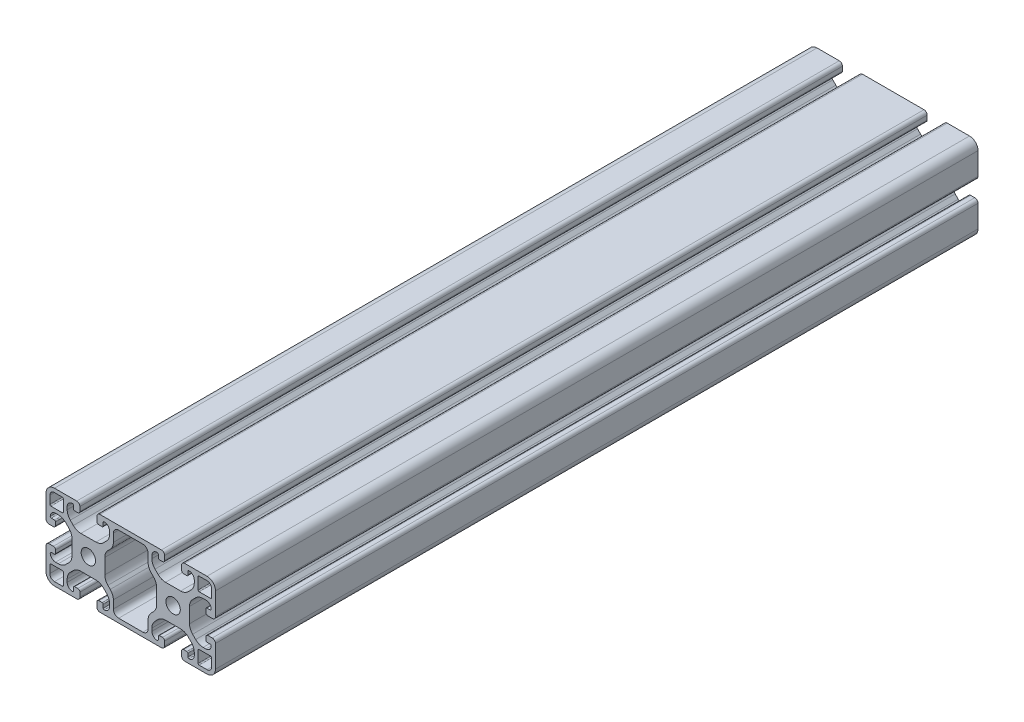
from build123d import *

# Parameters (mm, degrees)
ESQUISSE1_R        = 3.4
BOSS_EXTRU_1_DEPTH = 360


with BuildPart() as part:
    # Esquisse1 → Boss.-Extru.1 (new body)
    with BuildSketch(Plane.XY.offset(20)):
        with BuildLine():
            Line((66.5, 4.5), (65, 4.5))
            ThreePointArc((65, 4.5), (64.292893219, 4.207106781), (64, 3.5))
            Line((64, 3.5), (64, 1.5))
            ThreePointArc((64, 1.5), (64.439339828, 0.439339828), (65.5, 0))
            Line((65.5, 0), (76, 0))
            ThreePointArc((76, 0), (78.828427125, 1.171572875), (80, 4))
            Line((80, 4), (80, 14.5))
            ThreePointArc((80, 14.5), (79.560660172, 15.560660172), (78.5, 16))
            Line((78.5, 16), (76.5, 16))
            ThreePointArc((76.5, 16), (75.792893219, 15.707106781), (75.5, 15))
            Line((75.5, 15), (75.5, 13.5))
            ThreePointArc((75.5, 13.5), (75.646446609, 13.146446609), (76, 13))
            Line((76, 13), (77.5, 13))
            ThreePointArc((77.5, 13), (77.853553391, 12.853553391), (78, 12.5))
            ThreePointArc((78, 12.5), (77.267766953, 10.732233047), (75.5, 10))
            Line((75.5, 10), (74.192388155, 10))
            ThreePointArc((74.192388155, 10), (72.278970994, 10.380602337), (70.656854249, 11.464466094))
            Line((70.656854249, 11.464466094), (69.214466094, 12.906854249))
            ThreePointArc((69.214466094, 12.906854249), (68.130602337, 14.528970994), (67.75, 16.442388155))
            Line((67.75, 16.442388155), (67.75, 23.557611845))
            ThreePointArc((67.75, 23.557611845), (68.130602337, 25.471029006), (69.214466094, 27.093145751))
            Line((69.214466094, 27.093145751), (70.656854249, 28.535533906))
            ThreePointArc((70.656854249, 28.535533906), (72.278970994, 29.619397663), (74.192388155, 30))
            Line((74.192388155, 30), (75.5, 30))
            ThreePointArc((75.5, 30), (77.267766953, 29.267766953), (78, 27.5))
            ThreePointArc((78, 27.5), (77.853553391, 27.146446609), (77.5, 27))
            Line((77.5, 27), (76, 27))
            ThreePointArc((76, 27), (75.646446609, 26.853553391), (75.5, 26.5))
            Line((75.5, 26.5), (75.5, 25))
            ThreePointArc((75.5, 25), (75.792893219, 24.292893219), (76.5, 24))
            Line((76.5, 24), (78.5, 24))
            ThreePointArc((78.5, 24), (79.560660172, 24.439339828), (80, 25.5))
            Line((80, 25.5), (80, 36))
            ThreePointArc((80, 36), (78.828427125, 38.828427125), (76, 40))
            Line((76, 40), (65.5, 40))
            ThreePointArc((65.5, 40), (64.439339828, 39.560660172), (64, 38.5))
            Line((64, 38.5), (64, 36.5))
            ThreePointArc((64, 36.5), (64.292893219, 35.792893219), (65, 35.5))
            Line((65, 35.5), (66.5, 35.5))
            ThreePointArc((66.5, 35.5), (66.853553391, 35.646446609), (67, 36))
            Line((67, 36), (67, 37.5))
            ThreePointArc((67, 37.5), (67.146446609, 37.853553391), (67.5, 38))
            ThreePointArc((67.5, 38), (69.267766953, 37.267766953), (70, 35.5))
            Line((70, 35.5), (70, 34.192388155))
            ThreePointArc((70, 34.192388155), (69.619397663, 32.278970994), (68.535533906, 30.656854249))
            Line((68.535533906, 30.656854249), (67.093145751, 29.214466094))
            ThreePointArc((67.093145751, 29.214466094), (65.471029006, 28.130602337), (63.557611845, 27.75))
            Line((63.557611845, 27.75), (56.442388155, 27.75))
            ThreePointArc((56.442388155, 27.75), (54.528970994, 28.130602337), (52.906854249, 29.214466094))
            Line((52.906854249, 29.214466094), (51.464466094, 30.656854249))
            ThreePointArc((51.464466094, 30.656854249), (50.380602337, 32.278970994), (50, 34.192388155))
            Line((50, 34.192388155), (50, 35.5))
            ThreePointArc((50, 35.5), (50.732233047, 37.267766953), (52.5, 38))
            ThreePointArc((52.5, 38), (52.853553391, 37.853553391), (53, 37.5))
            Line((53, 37.5), (53, 36))
            ThreePointArc((53, 36), (53.146446609, 35.646446609), (53.5, 35.5))
            Line((53.5, 35.5), (55, 35.5))
            ThreePointArc((55, 35.5), (55.707106781, 35.792893219), (56, 36.5))
            Line((56, 36.5), (56, 38.5))
            ThreePointArc((56, 38.5), (55.560660172, 39.560660172), (54.5, 40))
            Line((54.5, 40), (25.5, 40))
            ThreePointArc((25.5, 40), (24.439339828, 39.560660172), (24, 38.5))
            Line((24, 38.5), (24, 36.5))
            ThreePointArc((24, 36.5), (24.292893219, 35.792893219), (25, 35.5))
            Line((25, 35.5), (26.5, 35.5))
            ThreePointArc((26.5, 35.5), (26.853553391, 35.646446609), (27, 36))
            Line((27, 36), (27, 37.5))
            ThreePointArc((27, 37.5), (27.146446609, 37.853553391), (27.5, 38))
            ThreePointArc((27.5, 38), (29.267766953, 37.267766953), (30, 35.5))
            Line((30, 35.5), (30, 34.192388155))
            ThreePointArc((30, 34.192388155), (29.619397663, 32.278970994), (28.535533906, 30.656854249))
            Line((28.535533906, 30.656854249), (27.093145751, 29.214466094))
            ThreePointArc((27.093145751, 29.214466094), (25.471029006, 28.130602337), (23.557611845, 27.75))
            Line((23.557611845, 27.75), (16.442388155, 27.75))
            ThreePointArc((16.442388155, 27.75), (14.528970994, 28.130602337), (12.906854249, 29.214466094))
            Line((12.906854249, 29.214466094), (11.464466094, 30.656854249))
            ThreePointArc((11.464466094, 30.656854249), (10.380602337, 32.278970994), (10, 34.192388155))
            Line((10, 34.192388155), (10, 35.5))
            ThreePointArc((10, 35.5), (10.732233047, 37.267766953), (12.5, 38))
            ThreePointArc((12.5, 38), (12.853553391, 37.853553391), (13, 37.5))
            Line((13, 37.5), (13, 36))
            ThreePointArc((13, 36), (13.146446609, 35.646446609), (13.5, 35.5))
            Line((13.5, 35.5), (15, 35.5))
            ThreePointArc((15, 35.5), (15.707106781, 35.792893219), (16, 36.5))
            Line((16, 36.5), (16, 38.5))
            ThreePointArc((16, 38.5), (15.560660172, 39.560660172), (14.5, 40))
            Line((14.5, 40), (4, 40))
            ThreePointArc((4, 40), (1.171572875, 38.828427125), (0, 36))
            Line((0, 36), (0, 25.5))
            ThreePointArc((0, 25.5), (0.439339828, 24.439339828), (1.5, 24))
            Line((1.5, 24), (3.5, 24))
            ThreePointArc((3.5, 24), (4.207106781, 24.292893219), (4.5, 25))
            Line((4.5, 25), (4.5, 26.5))
            ThreePointArc((4.5, 26.5), (4.353553391, 26.853553391), (4, 27))
            Line((4, 27), (2.5, 27))
            ThreePointArc((2.5, 27), (2.146446609, 27.146446609), (2, 27.5))
            ThreePointArc((2, 27.5), (2.732233047, 29.267766953), (4.5, 30))
            Line((4.5, 30), (5.807611845, 30))
            ThreePointArc((5.807611845, 30), (7.721029006, 29.619397663), (9.343145751, 28.535533906))
            Line((9.343145751, 28.535533906), (10.785533906, 27.093145751))
            ThreePointArc((10.785533906, 27.093145751), (11.869397663, 25.471029006), (12.25, 23.557611845))
            Line((12.25, 23.557611845), (12.25, 16.442388155))
            ThreePointArc((12.25, 16.442388155), (11.869397663, 14.528970994), (10.785533906, 12.906854249))
            Line((10.785533906, 12.906854249), (9.343145751, 11.464466094))
            ThreePointArc((9.343145751, 11.464466094), (7.721029006, 10.380602337), (5.807611845, 10))
            Line((5.807611845, 10), (4.5, 10))
            ThreePointArc((4.5, 10), (2.732233047, 10.732233047), (2, 12.5))
            ThreePointArc((2, 12.5), (2.146446609, 12.853553391), (2.5, 13))
            Line((2.5, 13), (4, 13))
            ThreePointArc((4, 13), (4.353553391, 13.146446609), (4.5, 13.5))
            Line((4.5, 13.5), (4.5, 15))
            ThreePointArc((4.5, 15), (4.207106781, 15.707106781), (3.5, 16))
            Line((3.5, 16), (1.5, 16))
            ThreePointArc((1.5, 16), (0.439339828, 15.560660172), (0, 14.5))
            Line((0, 14.5), (0, 4))
            ThreePointArc((0, 4), (1.171572875, 1.171572875), (4, 0))
            Line((4, 0), (14.5, 0))
            ThreePointArc((14.5, 0), (15.560660172, 0.439339828), (16, 1.5))
            Line((16, 1.5), (16, 3.5))
            ThreePointArc((16, 3.5), (15.707106781, 4.207106781), (15, 4.5))
            Line((15, 4.5), (13.5, 4.5))
            ThreePointArc((13.5, 4.5), (13.146446609, 4.353553391), (13, 4))
            Line((13, 4), (13, 2.5))
            ThreePointArc((13, 2.5), (12.853553391, 2.146446609), (12.5, 2))
            ThreePointArc((12.5, 2), (10.732233047, 2.732233047), (10, 4.5))
            Line((10, 4.5), (10, 5.807611845))
            ThreePointArc((10, 5.807611845), (10.380602337, 7.721029006), (11.464466094, 9.343145751))
            Line((11.464466094, 9.343145751), (12.906854249, 10.785533906))
            ThreePointArc((12.906854249, 10.785533906), (14.528970994, 11.869397663), (16.442388155, 12.25))
            Line((16.442388155, 12.25), (23.557611845, 12.25))
            ThreePointArc((23.557611845, 12.25), (25.471029006, 11.869397663), (27.093145751, 10.785533906))
            Line((27.093145751, 10.785533906), (28.535533906, 9.343145751))
            ThreePointArc((28.535533906, 9.343145751), (29.619397663, 7.721029006), (30, 5.807611845))
            Line((30, 5.807611845), (30, 4.5))
            ThreePointArc((30, 4.5), (29.267766953, 2.732233047), (27.5, 2))
            ThreePointArc((27.5, 2), (27.146446609, 2.146446609), (27, 2.5))
            Line((27, 2.5), (27, 4))
            ThreePointArc((27, 4), (26.853553391, 4.353553391), (26.5, 4.5))
            Line((26.5, 4.5), (25, 4.5))
            ThreePointArc((25, 4.5), (24.292893219, 4.207106781), (24, 3.5))
            Line((24, 3.5), (24, 1.5))
            ThreePointArc((24, 1.5), (24.439339828, 0.439339828), (25.5, 0))
            Line((25.5, 0), (54.5, 0))
            ThreePointArc((54.5, 0), (55.560660172, 0.439339828), (56, 1.5))
            Line((56, 1.5), (56, 3.5))
            ThreePointArc((56, 3.5), (55.707106781, 4.207106781), (55, 4.5))
            Line((55, 4.5), (53.5, 4.5))
            ThreePointArc((53.5, 4.5), (53.146446609, 4.353553391), (53, 4))
            Line((53, 4), (53, 2.5))
            ThreePointArc((53, 2.5), (52.853553391, 2.146446609), (52.5, 2))
            ThreePointArc((52.5, 2), (50.732233047, 2.732233047), (50, 4.5))
            Line((50, 4.5), (50, 5.807611845))
            ThreePointArc((50, 5.807611845), (50.380602337, 7.721029006), (51.464466094, 9.343145751))
            Line((51.464466094, 9.343145751), (52.906854249, 10.785533906))
            ThreePointArc((52.906854249, 10.785533906), (54.528970994, 11.869397663), (56.442388155, 12.25))
            Line((56.442388155, 12.25), (63.557611845, 12.25))
            ThreePointArc((63.557611845, 12.25), (65.471029006, 11.869397663), (67.093145751, 10.785533906))
            Line((67.093145751, 10.785533906), (68.535533906, 9.343145751))
            ThreePointArc((68.535533906, 9.343145751), (69.619397663, 7.721029006), (70, 5.807611845))
            Line((70, 5.807611845), (70, 4.5))
            ThreePointArc((70, 4.5), (69.267766953, 2.732233047), (67.5, 2))
            ThreePointArc((67.5, 2), (67.146446609, 2.146446609), (67, 2.5))
            Line((67, 2.5), (67, 4))
            ThreePointArc((67, 4), (66.853553391, 4.353553391), (66.5, 4.5))
        make_face()
        with Locations((20, 20)):
            Circle(ESQUISSE1_R, mode=Mode.SUBTRACT)
        with Locations((60, 20)):
            Circle(ESQUISSE1_R, mode=Mode.SUBTRACT)
        with BuildLine():
            Line((31.8, 4.5), (31.8, 8.250252532))
            ThreePointArc((31.8, 8.250252532), (31.419397663, 10.163669694), (30.335533906, 11.785786438))
            Line((30.335533906, 11.785786438), (29.214466094, 12.906854249))
            ThreePointArc((29.214466094, 12.906854249), (28.130602337, 14.528970994), (27.75, 16.442388155))
            Line((27.75, 16.442388155), (27.75, 23.557611845))
            ThreePointArc((27.75, 23.557611845), (28.130602337, 25.471029006), (29.214466094, 27.093145751))
            Line((29.214466094, 27.093145751), (30.335533906, 28.214213562))
            ThreePointArc((30.335533906, 28.214213562), (31.419397663, 29.836330306), (31.8, 31.749747468))
            Line((31.8, 31.749747468), (31.8, 35.5))
            ThreePointArc((31.8, 35.5), (32.532233047, 37.267766953), (34.3, 38))
            Line((34.3, 38), (45.7, 38))
            ThreePointArc((45.7, 38), (47.467766953, 37.267766953), (48.2, 35.5))
            Line((48.2, 35.5), (48.2, 31.749747468))
            ThreePointArc((48.2, 31.749747468), (48.580602337, 29.836330306), (49.664466094, 28.214213562))
            Line((49.664466094, 28.214213562), (50.785533906, 27.093145751))
            ThreePointArc((50.785533906, 27.093145751), (51.869397663, 25.471029006), (52.25, 23.557611845))
            Line((52.25, 23.557611845), (52.25, 16.442388155))
            ThreePointArc((52.25, 16.442388155), (51.869397663, 14.528970994), (50.785533906, 12.906854249))
            Line((50.785533906, 12.906854249), (49.664466094, 11.785786438))
            ThreePointArc((49.664466094, 11.785786438), (48.580602337, 10.163669694), (48.2, 8.250252532))
            Line((48.2, 8.250252532), (48.2, 4.5))
            ThreePointArc((48.2, 4.5), (47.467766953, 2.732233047), (45.7, 2))
            Line((45.7, 2), (34.3, 2))
            ThreePointArc((34.3, 2), (32.532233047, 2.732233047), (31.8, 4.5))
        make_face(mode=Mode.SUBTRACT)
        with BuildLine():
            Line((7.7, 1.8), (4, 1.8))
            ThreePointArc((4, 1.8), (2.444365081, 2.444365081), (1.8, 4))
            Line((1.8, 4), (1.8, 7.7))
            ThreePointArc((1.8, 7.7), (1.946446609, 8.053553391), (2.3, 8.2))
            Line((2.3, 8.2), (7.7, 8.2))
            ThreePointArc((7.7, 8.2), (8.053553391, 8.053553391), (8.2, 7.7))
            Line((8.2, 7.7), (8.2, 2.3))
            ThreePointArc((8.2, 2.3), (8.053553391, 1.946446609), (7.7, 1.8))
        make_face(mode=Mode.SUBTRACT)
        with BuildLine():
            Line((72.3, 38.2), (76, 38.2))
            ThreePointArc((76, 38.2), (77.555634919, 37.555634919), (78.2, 36))
            Line((78.2, 36), (78.2, 32.3))
            ThreePointArc((78.2, 32.3), (78.053553391, 31.946446609), (77.7, 31.8))
            Line((77.7, 31.8), (72.3, 31.8))
            ThreePointArc((72.3, 31.8), (71.946446609, 31.946446609), (71.8, 32.3))
            Line((71.8, 32.3), (71.8, 37.7))
            ThreePointArc((71.8, 37.7), (71.946446609, 38.053553391), (72.3, 38.2))
        make_face(mode=Mode.SUBTRACT)
        with BuildLine():
            Line((78.2, 7.7), (78.2, 4))
            ThreePointArc((78.2, 4), (77.555634919, 2.444365081), (76, 1.8))
            Line((76, 1.8), (72.3, 1.8))
            ThreePointArc((72.3, 1.8), (71.946446609, 1.946446609), (71.8, 2.3))
            Line((71.8, 2.3), (71.8, 7.7))
            ThreePointArc((71.8, 7.7), (71.946446609, 8.053553391), (72.3, 8.2))
            Line((72.3, 8.2), (77.7, 8.2))
            ThreePointArc((77.7, 8.2), (78.053553391, 8.053553391), (78.2, 7.7))
        make_face(mode=Mode.SUBTRACT)
        with BuildLine():
            Line((1.8, 32.3), (1.8, 36))
            ThreePointArc((1.8, 36), (2.444365081, 37.555634919), (4, 38.2))
            Line((4, 38.2), (7.7, 38.2))
            ThreePointArc((7.7, 38.2), (8.053553391, 38.053553391), (8.2, 37.7))
            Line((8.2, 37.7), (8.2, 32.3))
            ThreePointArc((8.2, 32.3), (8.053553391, 31.946446609), (7.7, 31.8))
            Line((7.7, 31.8), (2.3, 31.8))
            ThreePointArc((2.3, 31.8), (1.946446609, 31.946446609), (1.8, 32.3))
        make_face(mode=Mode.SUBTRACT)
    extrude(amount=-BOSS_EXTRU_1_DEPTH)


solid = part.part
